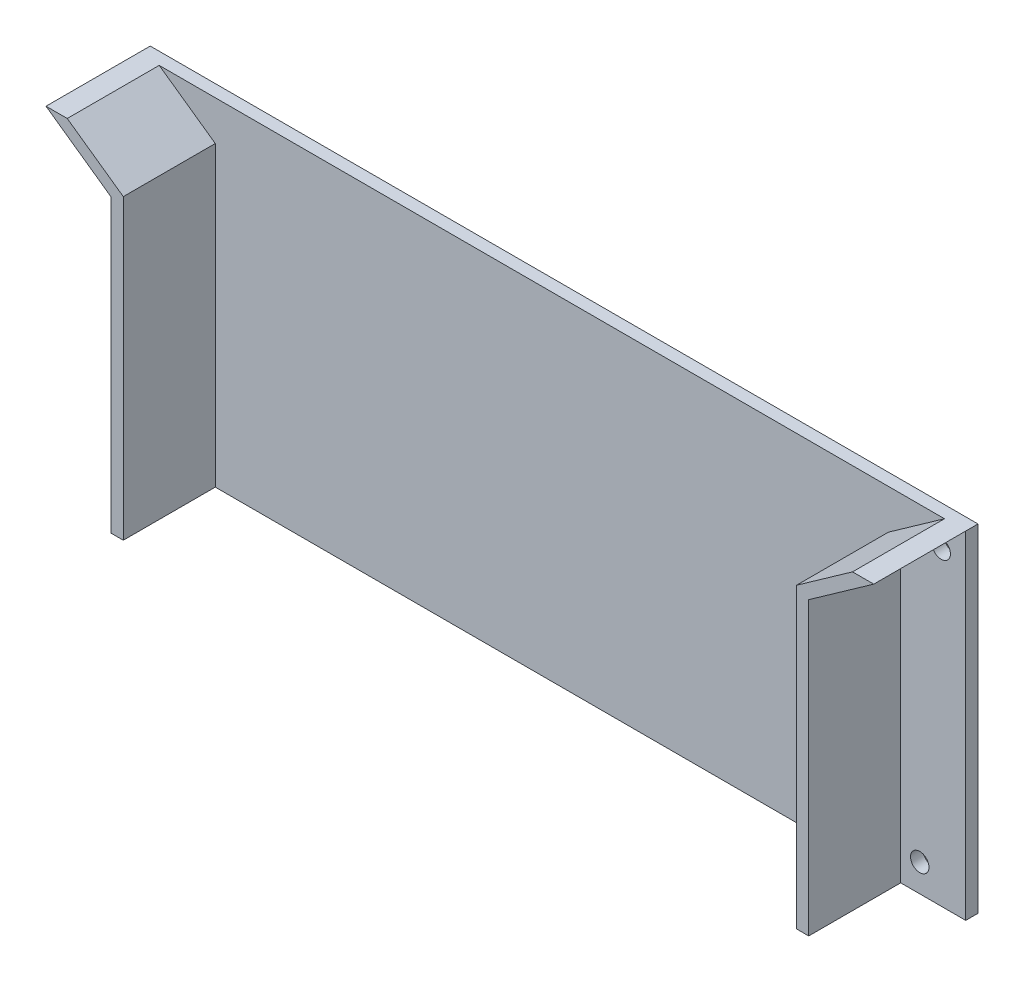
from build123d import *

# Parameters (mm, degrees)
SKETCH1_W           = 270
SKETCH1_H           = 110
BOSS_EXTRUDE1_DEPTH = 4
BOSS_EXTRUDE2_DEPTH = 30
SKETCH3_R           = 3
CUT_EXTRUDE1_DEPTH  = 30


with BuildPart() as part:
    # Sketch1 → Boss-Extrude1 (new body)
    with BuildSketch(Plane.XY):
        Rectangle(SKETCH1_W, SKETCH1_H)
    extrude(amount=BOSS_EXTRUDE1_DEPTH)

    # Sketch2 → Boss-Extrude2 (add)
    with BuildSketch(Plane.XY.offset(4)):
        Polygon((-128.071344503, 55), (-135, 55), (-113.784719429, 40), (-113.784719429, -55), (-109.784719429, -55), (-109.784719429, 42.070669408), align=None)
        Polygon((128.071344503, 55), (109.784719429, 42.070669408), (109.784719429, -55), (113.784719429, -55), (113.784719429, 40), (135, 55), align=None)
    extrude(amount=BOSS_EXTRUDE2_DEPTH)

    # Sketch3 → Cut-Extrude1 (cut)
    with BuildSketch(Plane.XY.offset(4)):
        with Locations((-120, -46)):
            Circle(SKETCH3_R)
        with Locations((120, -46)):
            Circle(SKETCH3_R)
        with Locations((127, 46)):
            Circle(SKETCH3_R)
        with Locations((-127, 46)):
            Circle(SKETCH3_R)
    extrude(amount=-CUT_EXTRUDE1_DEPTH, mode=Mode.SUBTRACT)


solid = part.part
